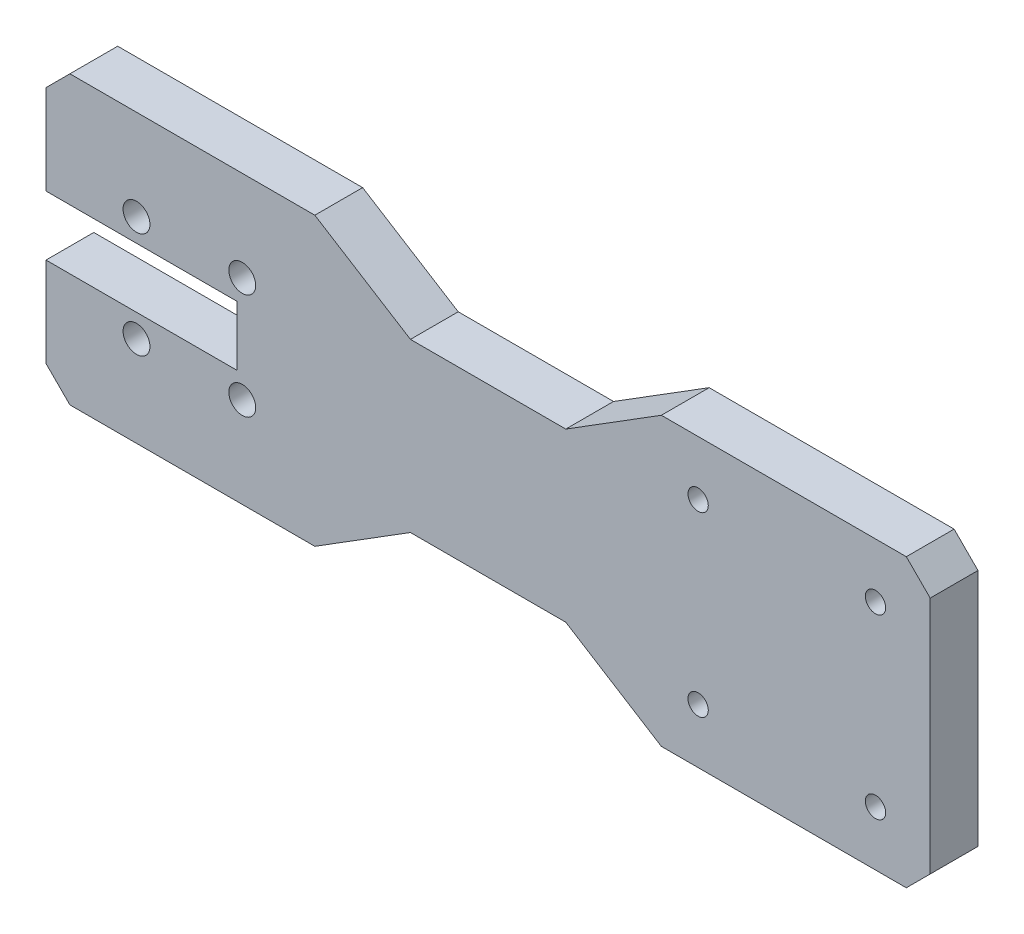
from build123d import *

# Parameters (mm, degrees)
SKETCH_1_R        = 2.25
SKETCH_1_R_2      = 1.7
EXTRUDE_259_DEPTH = 8


with BuildPart() as part:
    # 草图1 → Extrude 259 (new body)
    with BuildSketch(Plane.XY):
        Polygon((-24, -20), (-20, -24), (21, -24), (37, -14), (63, -14), (79, -24), (120, -24), (124, -20), (124, 20), (120, 24), (79, 24), (63, 14), (37, 14), (21, 24), (-20, 24), (-24, 20), (-24, 5), (8, 5), (8, -5), (-24, -5), align=None)
        with Locations((-8.85, -8.85)):
            Circle(SKETCH_1_R, mode=Mode.SUBTRACT)
        with Locations((-8.85, 8.85)):
            Circle(SKETCH_1_R, mode=Mode.SUBTRACT)
        with Locations((8.85, -8.85)):
            Circle(SKETCH_1_R, mode=Mode.SUBTRACT)
        with Locations((8.85, 8.85)):
            Circle(SKETCH_1_R, mode=Mode.SUBTRACT)
        with Locations((85.155, -14.845)):
            Circle(SKETCH_1_R_2, mode=Mode.SUBTRACT)
        with Locations((85.155, 14.845)):
            Circle(SKETCH_1_R_2, mode=Mode.SUBTRACT)
        with Locations((114.845, -14.845)):
            Circle(SKETCH_1_R_2, mode=Mode.SUBTRACT)
        with Locations((114.845, 14.845)):
            Circle(SKETCH_1_R_2, mode=Mode.SUBTRACT)
    extrude(amount=EXTRUDE_259_DEPTH)


solid = part.part
